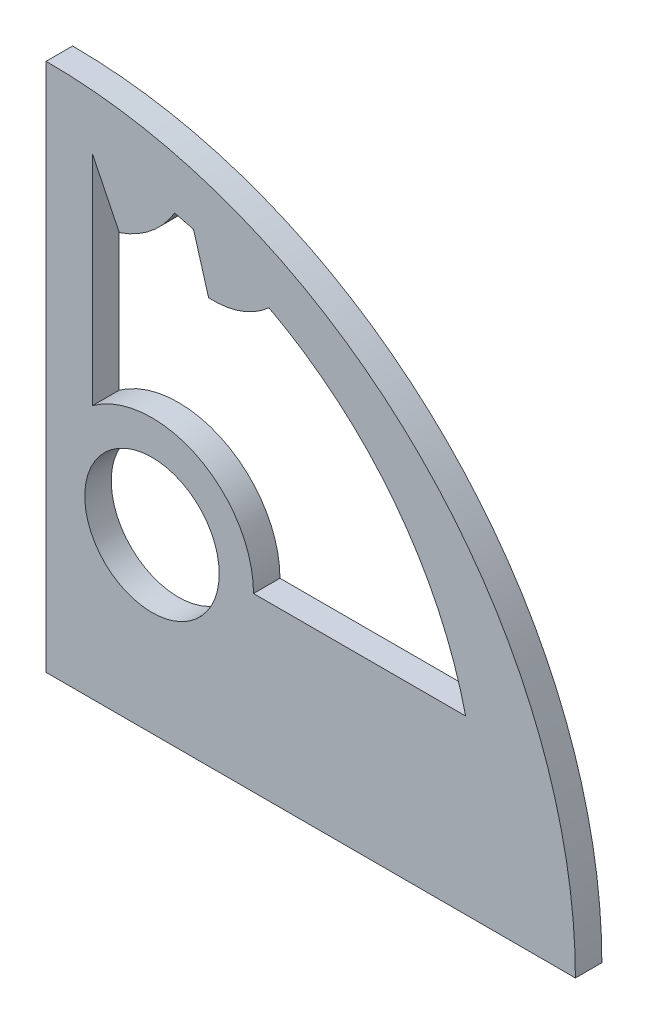
from build123d import *

# Parameters (mm, degrees)
SALIENTE_EXTRUIR1_DEPTH = 5
CROQUIS2_R              = 12.7
CORTAR_EXTRUIR1_DEPTH   = 10
CORTAR_EXTRUIR2_DEPTH   = 10


with BuildPart() as part:
    # Croquis1 → Saliente-Extruir1 (new body)
    with BuildSketch(Plane.XY):
        with BuildLine():
            Line((0, 100), (0, 0))
            Line((0, 0), (100, 0))
            ThreePointArc((100, 0), (70.710678119, 70.710678119), (0, 100))
        make_face()
    extrude(amount=SALIENTE_EXTRUIR1_DEPTH)

    # Croquis2 → Cortar-Extruir1 (cut)
    with BuildSketch(Plane.XY.offset(5)):
        with Locations((20, 32.5)):
            Circle(CROQUIS2_R)
    extrude(amount=-CORTAR_EXTRUIR1_DEPTH, mode=Mode.SUBTRACT)

    # Croquis3 → Cortar-Extruir2 (cut)
    with BuildSketch(Plane.XY.offset(5)):
        with BuildLine():
            Line((8.78881249, 48.063247001), (8.78881249, 89.15262579))
            Line((8.78881249, 89.15262579), (13.826190337, 78.875233565))
            ThreePointArc((13.826190337, 78.875233565), (19.806584532, 82.16151857), (24.282169152, 87.312627788))
            ThreePointArc((24.282169152, 87.312627788), (26.07485748, 86.878519508), (27.856038853, 86.399380324))
            Line((27.856038853, 86.399380324), (30.697722068, 76.655190323))
            ThreePointArc((30.697722068, 76.655190323), (36.801955218, 77.531012101), (42.084756772, 80.712322191))
            ThreePointArc((42.084756772, 80.712322191), (65.921457687, 60.654047665), (79.258334665, 32.5))
            Line((79.258334665, 32.5), (39.180859798, 32.5))
            ThreePointArc((39.180859798, 32.5), (28.742573042, 49.572574475), (8.78881249, 48.063247001))
        make_face()
    extrude(amount=-CORTAR_EXTRUIR2_DEPTH, mode=Mode.SUBTRACT)


solid = part.part
